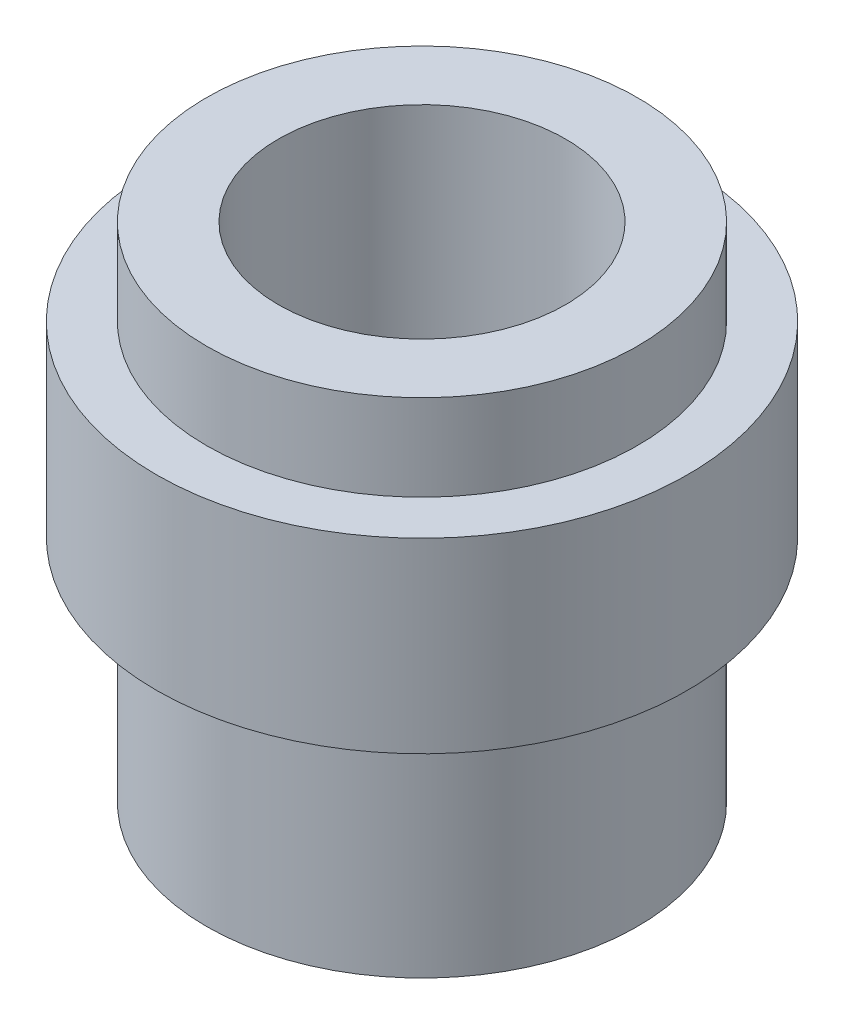
from build123d import *

# Parameters (mm, degrees)
SKETCH_2_R          = 10
CUT_EXTRUDE_1_DEPTH = 45


with BuildPart() as part:
    # Эскиз1 → Повернуть1 (revolve)
    with BuildSketch(Plane.XY, mode=Mode.PRIVATE) as revolve_1_sk:
        Polygon((0, 37.581413689), (15, 37.581413689), (15, 31.581413689), (18.5, 31.581413689), (18.5, 18.581413689), (15, 18.581413689), (15, 2.581413689), (0, 2.581413689), align=None)
    revolve(revolve_1_sk.sketch.rotate(Axis((0, 46.50337763, 0), (0, -1, 0)), 90), axis=Axis((0, 46.50337763, 0), (0, -1, 0)))

    # Эскиз2 → Вырез-Вытянуть1 (cut)
    with BuildSketch(Plane(origin=(0, 37.581413689, 0), x_dir=(1, 0, 0), z_dir=(0, 1, 0))):
        with Locations(Location((0, 0, 0), (0, 0, 270))):
            Circle(SKETCH_2_R)
    extrude(amount=-CUT_EXTRUDE_1_DEPTH, mode=Mode.SUBTRACT)


solid = part.part
